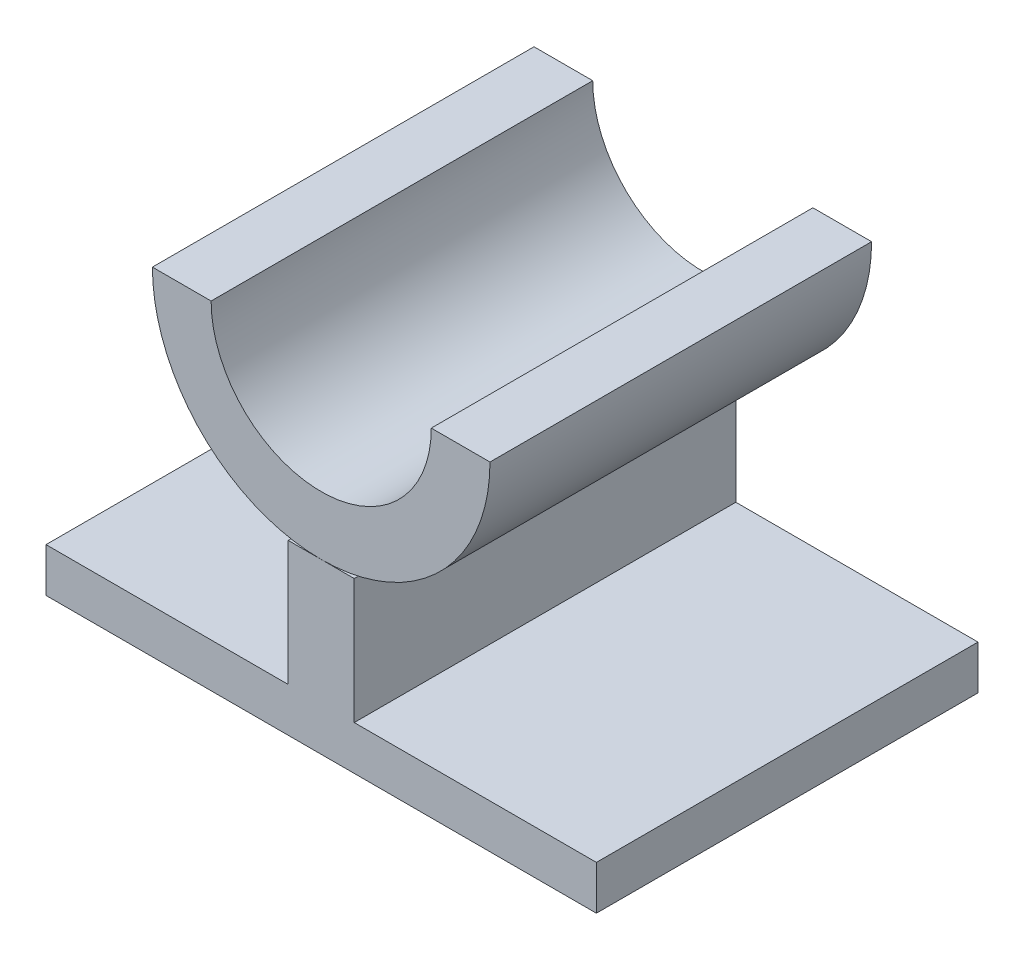
from build123d import *

# Parameters (mm, degrees)
SKETCH1_W           = 75
SKETCH1_H           = 52
BOSS_EXTRUDE1_DEPTH = 6
SKETCH2_W           = 9
SKETCH2_H           = 52
BOSS_EXTRUDE2_DEPTH = 17
BOSS_EXTRUDE3_DEPTH = 52


with BuildPart() as part:
    # Sketch1 → Boss-Extrude1 (new body)
    with BuildSketch(Plane(origin=(0, 0, 0), x_dir=(1, 0, 0), z_dir=(0, 1, 0))):
        Rectangle(SKETCH1_W, SKETCH1_H)
    extrude(amount=BOSS_EXTRUDE1_DEPTH)

    # Sketch2 → Boss-Extrude2 (add)
    with BuildSketch(Plane(origin=(0, 6, 0), x_dir=(1, 0, 0), z_dir=(0, 1, 0))):
        Rectangle(SKETCH2_W, SKETCH2_H)
    extrude(amount=BOSS_EXTRUDE2_DEPTH)


with BuildPart() as body_2:
    # Sketch3 → Boss-Extrude3 (new body)
    with BuildSketch(Plane.XY.offset(26)):
        with BuildLine():
            Line((-23, 46), (-15, 46))
            ThreePointArc((-15, 46), (0, 31), (15, 46))
            Line((15, 46), (23, 46))
            ThreePointArc((23, 46), (0, 23), (-23, 46))
        make_face()
    extrude(amount=-BOSS_EXTRUDE3_DEPTH)


solid = Compound([part.part, body_2.part])
